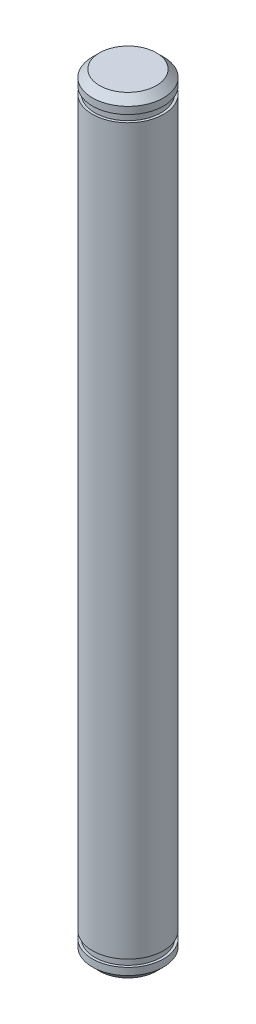
from build123d import *

# Parameters (mm, degrees)
CHAMFER_1_SIZE      = 1
CUT_EXTRUDE_START   = -3
SKETCH_2_R          = 5
SKETCH_2_R_2        = 4.65
CUT_EXTRUDE_1_DEPTH = 1


with BuildPart() as part:
    # 草图1 → 旋转1 (revolve)
    with BuildSketch(Plane.XY, mode=Mode.PRIVATE) as revolve_1_sk:
        Polygon((0, 54), (5, 54), (5, 15), (5, -15), (5, -54), (0, -54), align=None)
    revolve(revolve_1_sk.sketch.rotate(Axis((0, 54, 0), (0, -1, 0)), 180), axis=Axis((0, 54, 0), (0, -1, 0)))

    # 倒角1
    chamfer_1_edges = [part.edges().sort_by_distance(p)[0] for p in [
        (5, -54, 0),
        (5, 54, 0),
    ]]
    chamfer(chamfer_1_edges, length=CHAMFER_1_SIZE)

    # 草图2 → 切除-拉伸1 (cut)
    with BuildSketch(Plane(origin=(0, 54, 0), x_dir=(1, 0, 0), z_dir=(0, 1, 0)).offset(CUT_EXTRUDE_START)):
        with Locations(Location((0, 0, 0), (0, 0, 180))):
            Circle(SKETCH_2_R)
        with Locations(Location((0, 0, 0), (0, 0, 180))):
            Circle(SKETCH_2_R_2, mode=Mode.SUBTRACT)
    cut_extrude_1 = extrude(amount=CUT_EXTRUDE_1_DEPTH, mode=Mode.SUBTRACT)

    # 镜向1: 切除-拉伸1 across plane
    add(cut_extrude_1.mirror(Plane.ZX), mode=Mode.SUBTRACT)


solid = part.part
